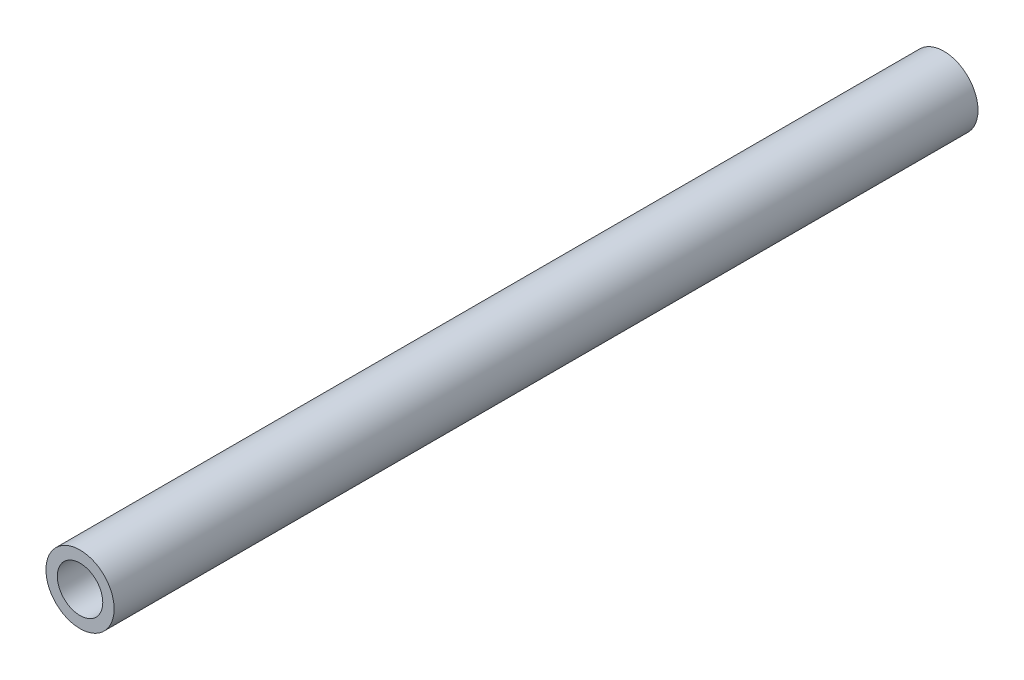
from build123d import *

# Parameters (mm, degrees)
SKETCH1_R           = 1.5
SKETCH1_R_2         = 1
BOSS_EXTRUDE1_DEPTH = 38


with BuildPart() as part:
    # Sketch1 → Boss-Extrude1 (new body)
    with BuildSketch(Plane.XY):
        Circle(SKETCH1_R)
        Circle(SKETCH1_R_2, mode=Mode.SUBTRACT)
    extrude(amount=BOSS_EXTRUDE1_DEPTH)


solid = part.part
